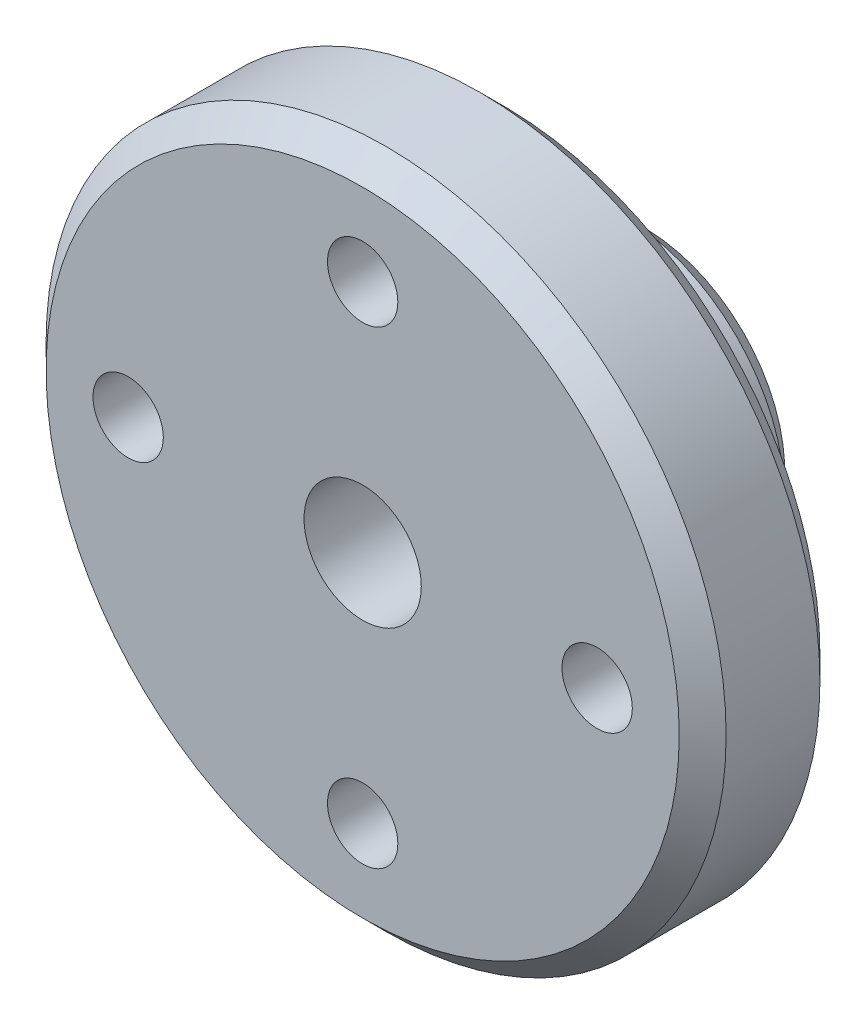
from build123d import *

# Parameters (mm, degrees)
SKETCH1_R           = 7.25
BOSS_EXTRUDE1_DEPTH = 3
SKETCH2_R           = 3.5
SKETCH2_R_2         = 2.5
BOSS_EXTRUDE2_DEPTH = 3
SKETCH3_R           = 0.75
CUT_EXTRUDE1_DEPTH  = 12.879604371
CHAMFER1_SIZE       = 0.5
SKETCH5_R           = 1.25
CUT_EXTRUDE3_DEPTH  = 12.879604371


with BuildPart() as part:
    # Sketch1 → Boss-Extrude1 (new body)
    with BuildSketch(Plane.XY):
        Circle(SKETCH1_R)
    extrude(amount=BOSS_EXTRUDE1_DEPTH)

    # Sketch2 → Boss-Extrude2 (add)
    with BuildSketch(Plane(origin=(0, 0, 0), x_dir=(-1, 0, 0), z_dir=(0, 0, -1))):
        with Locations(Location((0, 0, 0), (0, 0, 180))):
            Circle(SKETCH2_R)
        Circle(SKETCH2_R_2, mode=Mode.SUBTRACT)
    extrude(amount=BOSS_EXTRUDE2_DEPTH)

    # Sketch3 → Cut-Extrude1 (cut, through all)
    with BuildSketch(Plane.XY.offset(3)):
        with Locations((0, 5)):
            Circle(SKETCH3_R)
        with Locations((5, 0)):
            Circle(SKETCH3_R)
        with Locations((0, -5)):
            Circle(SKETCH3_R)
        with Locations((-5, 0)):
            Circle(SKETCH3_R)
    extrude(amount=-CUT_EXTRUDE1_DEPTH, mode=Mode.SUBTRACT)

    # Chamfer1
    chamfer1_edges = [part.edges().sort_by_distance(p)[0] for p in [
        (-7.25, 0, 0),
        (-7.25, 0, 3),
        (-3.5, 0, -3),
    ]]
    chamfer(chamfer1_edges, length=CHAMFER1_SIZE)

    # Sketch5 → Cut-Extrude3 (cut, through all)
    with BuildSketch(Plane.XY.offset(3)):
        Circle(SKETCH5_R)
    extrude(amount=-CUT_EXTRUDE3_DEPTH, mode=Mode.SUBTRACT)


solid = part.part
